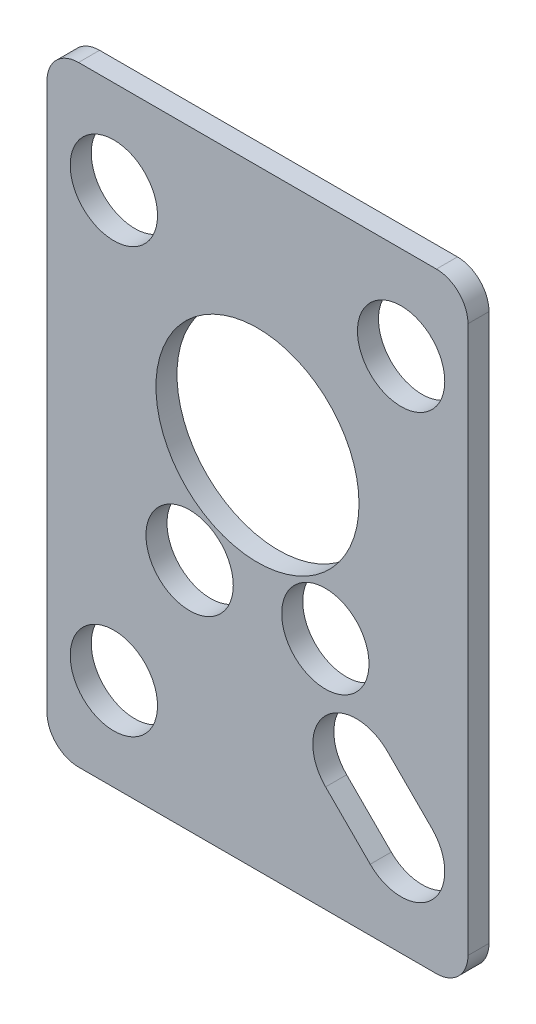
from build123d import *

# Parameters (mm, degrees)
SKETCH1_R           = 9.65
SKETCH1_R_2         = 4.15
BOSS_EXTRUDE1_DEPTH = 2


with BuildPart() as part:
    # Sketch1 → Boss-Extrude1 (new body)
    with BuildSketch(Plane.XY):
        with BuildLine():
            Line((17.005, -29), (-17.005, -29))
            ThreePointArc((-17.005, -29), (-19.126320344, -28.121320344), (-20.005, -26))
            Line((-20.005, -26), (-20.005, 26))
            ThreePointArc((-20.005, 26), (-19.126320344, 28.121320344), (-17.005, 29))
            Line((-17.005, 29), (17.005, 29))
            ThreePointArc((17.005, 29), (19.126320344, 28.121320344), (20.005, 26))
            Line((20.005, 26), (20.005, -26))
            ThreePointArc((20.005, -26), (19.126320344, -28.121320344), (17.005, -29))
        make_face()
        with Locations((0, 6)):
            Circle(SKETCH1_R, mode=Mode.SUBTRACT)
        with Locations((13.65, 20.15)):
            Circle(SKETCH1_R_2, mode=Mode.SUBTRACT)
        with Locations((6.45, -6.7)):
            Circle(SKETCH1_R_2, mode=Mode.SUBTRACT)
        with Locations((-6.45, -6.7)):
            Circle(SKETCH1_R_2, mode=Mode.SUBTRACT)
        with Locations((-13.65, -20.2)):
            Circle(SKETCH1_R_2, mode=Mode.SUBTRACT)
        with Locations((-13.65, 20.15)):
            Circle(SKETCH1_R_2, mode=Mode.SUBTRACT)
        with BuildLine():
            Line((10.715506858, -23.134493142), (6.472866171, -18.891852455))
            ThreePointArc((6.472866171, -18.891852455), (6.472866171, -13.022866171), (12.341852455, -13.022866171))
            Line((12.341852455, -13.022866171), (16.584493142, -17.265506858))
            ThreePointArc((16.584493142, -17.265506858), (16.584493142, -23.134493142), (10.715506858, -23.134493142))
        make_face(mode=Mode.SUBTRACT)
    extrude(amount=BOSS_EXTRUDE1_DEPTH)


solid = part.part
